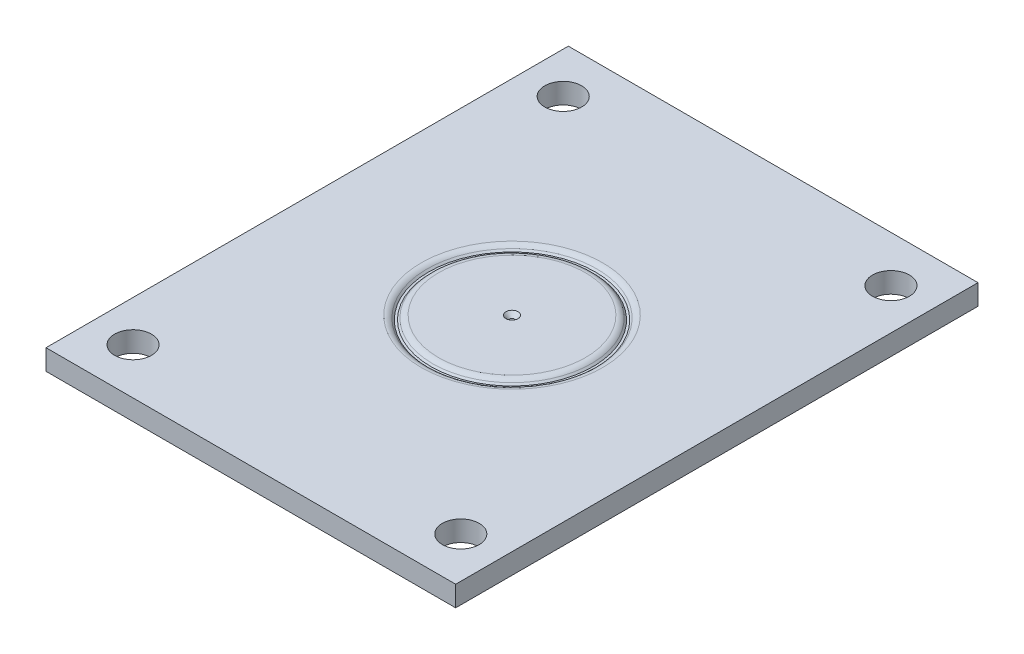
from build123d import *

# Parameters (mm, degrees)
SKETCH1_W           = 200
SKETCH1_H           = 255
BOSS_EXTRUDE1_DEPTH = 10
SKETCH2_R           = 49.592553134
CUT_EXTRUDE1_DEPTH  = 3
SKETCH3_R           = 9
CUT_EXTRUDE2_DEPTH  = 69
SKETCH4_R           = 42.638858135
SKETCH4_R_2         = 37.540647577
CUT_EXTRUDE3_DEPTH  = 2
CUT_EXTRUDE3_DRAFT  = -45
FILLET1_R           = 4
FILLET2_R           = 4
SKETCH5_R           = 2.952313346
CUT_EXTRUDE4_DEPTH  = 2
CUT_EXTRUDE4_DRAFT  = -45


with BuildPart() as part:
    # Sketch1 → Boss-Extrude1 (new body)
    with BuildSketch(Plane(origin=(0, 0, 0), x_dir=(1, 0, 0), z_dir=(0, 1, 0))):
        with Locations((17.363344051, -80.072347267)):
            Rectangle(SKETCH1_W, SKETCH1_H)
    extrude(amount=BOSS_EXTRUDE1_DEPTH)

    # Sketch2 → Cut-Extrude1 (cut)
    with BuildSketch(Plane(origin=(0, 0, 0), x_dir=(-1, 0, 0), z_dir=(0, -1, 0))):
        with Locations(Location((-17.363344051, -80.072347267, 0), (0, 0, 90))):
            Circle(SKETCH2_R)
    extrude(amount=-CUT_EXTRUDE1_DEPTH, mode=Mode.SUBTRACT)

    # Sketch3 → Cut-Extrude2 (cut)
    with BuildSketch(Plane(origin=(0, 10, 0), x_dir=(1, 0, 0), z_dir=(0, 1, 0))):
        with Locations(Location((97.363344051, -185.072347267, 0), (0, 0, 270))):
            Circle(SKETCH3_R)
        with Locations(Location((-62.636655949, 24.927652733, 0), (0, 0, 270))):
            Circle(SKETCH3_R)
        with Locations(Location((-62.636655949, -185.072347267, 0), (0, 0, 270))):
            Circle(SKETCH3_R)
        with Locations(Location((97.363344051, 24.927652733, 0), (0, 0, 270))):
            Circle(SKETCH3_R)
    extrude(amount=-CUT_EXTRUDE2_DEPTH, mode=Mode.SUBTRACT)


with BuildPart() as cut_extrude3_tool:
    # Sketch4 → Cut-Extrude3 (with draft: the straight prism first)
    with BuildSketch(Plane(origin=(0, 10, 0), x_dir=(1, 0, 0), z_dir=(0, 1, 0))):
        with Locations((17.363344051, -80.072347267)):
            Circle(SKETCH4_R)
        with Locations((17.363344051, -80.072347267)):
            Circle(SKETCH4_R_2, mode=Mode.SUBTRACT)
    extrude(amount=-CUT_EXTRUDE3_DEPTH)
    # Cut-Extrude3: the draft: its side faces are tilted about the plane it starts from
    cut_extrude3_sides = [cut_extrude3_tool.faces().sort_by_distance(p)[0] for p in [
        (-25.275514084, 9, 80.072347267),
        (-20.177303525, 9, 80.072347267),
    ]]
    draft(cut_extrude3_sides, Plane(origin=(0, 10, 0), x_dir=(1, 0, 0), z_dir=(0, 1, 0)), CUT_EXTRUDE3_DRAFT)


with BuildPart() as part_1:
    add(part.part)

    # Cut-Extrude3: cut by cut_extrude3_tool
    add(cut_extrude3_tool.part, mode=Mode.SUBTRACT)

    # Fillet1
    fillet1_edges = [part_1.edges().sort_by_distance(p)[0] for p in [
        (-25.275514084, 10, 80.072347267),
    ]]
    fillet(fillet1_edges, radius=FILLET1_R)

    # Fillet2
    fillet2_edges = [part_1.edges().sort_by_distance(p)[0] for p in [
        (-20.177303525, 10, 80.072347267),
    ]]
    fillet(fillet2_edges, radius=FILLET2_R)


with BuildPart() as cut_extrude4_tool:
    # Sketch5 → Cut-Extrude4 (with draft: the straight prism first)
    with BuildSketch(Plane(origin=(0, 10, 0), x_dir=(1, 0, 0), z_dir=(0, 1, 0))):
        with Locations((17.363344051, -80.072347267)):
            Circle(SKETCH5_R)
    extrude(amount=-CUT_EXTRUDE4_DEPTH)
    # Cut-Extrude4: the draft: its side faces are tilted about the plane it starts from
    cut_extrude4_sides = [cut_extrude4_tool.faces().sort_by_distance(p)[0] for p in [
        (14.411030705, 9, 80.072347267),
    ]]
    draft(cut_extrude4_sides, Plane(origin=(0, 10, 0), x_dir=(1, 0, 0), z_dir=(0, 1, 0)), CUT_EXTRUDE4_DRAFT)


with BuildPart() as part_2:
    add(part_1.part)

    # Cut-Extrude4: cut by cut_extrude4_tool
    add(cut_extrude4_tool.part, mode=Mode.SUBTRACT)


solid = part_2.part
